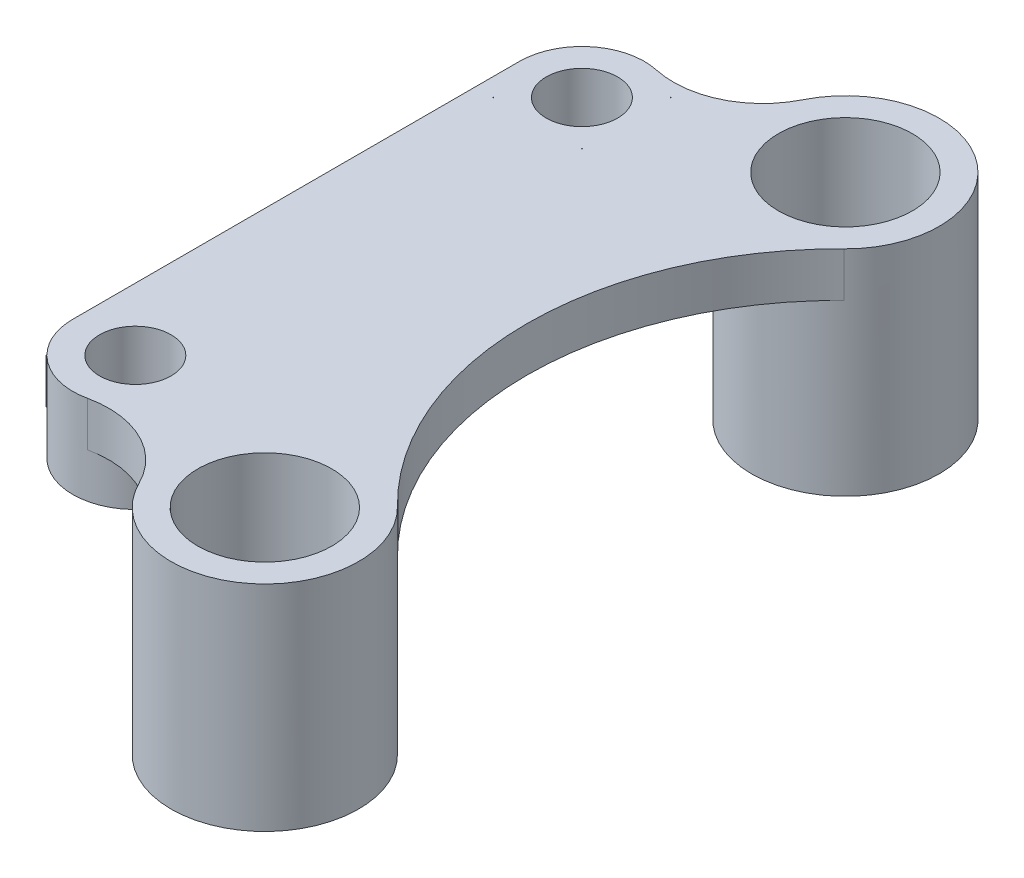
from build123d import *
from build123d.topology import SkipClean

# Parameters (mm, degrees)
SKETCH1_R                = 4
SKETCH1_R_2              = 7.5
BOSS_EXTRUDE1_DEPTH      = 5
BOSS_EXTRUDE2_START      = -5
SKETCH1_3_R              = 7
SKETCH1_3_R_2            = 4
BOSS_EXTRUDE2_DEPTH      = 5
BOSS_EXTRUDE3_DEPTH      = 5
BOSS_EXTRUDE3_DEPTH_BACK = 19
SKETCH1_4_R              = 10.5
SKETCH1_4_R_2            = 7.5


with BuildPart() as part:
    # Sketch1 → Boss-Extrude1 (new body)
    with BuildSketch(Plane(origin=(0, 0, 0), x_dir=(1, 0, 0), z_dir=(0, 1, 0))):
        with BuildLine():
            Line((2, -30), (2.101020514, -30))
            ThreePointArc((2.101020514, -30), (5.066288205, -31.727611663), (8.496335544, -31.838200051))
            ThreePointArc((8.496335544, -31.838200051), (14.961261821, -32.591823522), (19.59300275, -37.164590308))
            ThreePointArc((19.59300275, -37.164590308), (35.168768008, -40.996840663), (36.348469228, -25))
            ThreePointArc((36.348469228, -25), (25.843366656, 0), (36.348469228, 25))
            ThreePointArc((36.348469228, 25), (35.168768008, 40.996840663), (19.59300275, 37.164590308))
            ThreePointArc((19.59300275, 37.164590308), (14.961261821, 32.591823522), (8.496335544, 31.838200051))
            ThreePointArc((8.496335544, 31.838200051), (2.611056437, 30.45318021), (0, 25))
            Line((0, 25), (0, -25))
            ThreePointArc((0, -25), (0.519259302, -27.645751311), (2, -29.898979486))
            Line((2, -29.898979486), (2, -30))
        make_face()
        with Locations(Location((7, -25, 0), (0, 0, 270))):
            Circle(SKETCH1_R, mode=Mode.SUBTRACT)
        with BuildLine():
            Line((2, 20), (2, 20.101020514))
            ThreePointArc((2, 20.101020514), (2.050252532, 20.050252532), (2.101020514, 20))
            Line((2.101020514, 20), (2, 20))
        make_face(mode=Mode.SUBTRACT)
        with BuildLine():
            ThreePointArc((11.898979486, 20), (11.949747468, 20.050252532), (12, 20.101020514))
            Line((12, 20.101020514), (12, 20))
            Line((12, 20), (11.898979486, 20))
        make_face(mode=Mode.SUBTRACT)
        with Locations(Location((7, 25, 0), (0, 0, 270))):
            Circle(SKETCH1_R, mode=Mode.SUBTRACT)
        with BuildLine():
            ThreePointArc((12, 29.898979486), (11.949747468, 29.949747468), (11.898979486, 30))
            Line((11.898979486, 30), (12, 30))
            Line((12, 30), (12, 29.898979486))
        make_face(mode=Mode.SUBTRACT)
        with Locations(Location((29, 32.5, 0), (0, 0, 270))):
            Circle(SKETCH1_R_2, mode=Mode.SUBTRACT)
        with Locations(Location((29, -32.5, 0), (0, 0, 270))):
            Circle(SKETCH1_R_2, mode=Mode.SUBTRACT)
    extrude(amount=BOSS_EXTRUDE1_DEPTH)

    # Sketch1<3> → Boss-Extrude2 (add)
    # profile 1 of 2: a face of its own
    with BuildSketch(Plane(origin=(0, 0, 0), x_dir=(1, 0, 0), z_dir=(0, 1, 0)).offset(BOSS_EXTRUDE2_START)):
        with Locations(Location((7, 25, 0), (0, 0, 77.657080359))):
            Circle(SKETCH1_3_R)
        with Locations(Location((7, 25, 0), (0, 0, 270))):
            Circle(SKETCH1_3_R_2, mode=Mode.SUBTRACT)
    # profile 2 of 2: a face of its own
    with BuildSketch(Plane(origin=(0, 0, 0), x_dir=(1, 0, 0), z_dir=(0, 1, 0)).offset(BOSS_EXTRUDE2_START)):
        with Locations(Location((7, -25, 0), (0, 0, 180))):
            Circle(SKETCH1_3_R)
        with Locations(Location((7, -25, 0), (0, 0, 270))):
            Circle(SKETCH1_3_R_2, mode=Mode.SUBTRACT)
    extrude(amount=BOSS_EXTRUDE2_DEPTH)

    # Sketch1<4> → Boss-Extrude3 (add, two sides: drawn at the far end of the back side and taken through both)
    # profile 1 of 2: a face of its own
    with SkipClean():  # the faces are left unmerged after this step: merging them gives an invalid solid
        with BuildSketch(Plane(origin=(0, 0, 0), x_dir=(1, 0, 0), z_dir=(0, 1, 0)).offset(-BOSS_EXTRUDE3_DEPTH_BACK)):
            with Locations(Location((29, 32.5, 0), (0, 0, 153.62484734))):
                Circle(SKETCH1_4_R)
            with Locations(Location((29, 32.5, 0), (0, 0, 270))):
                Circle(SKETCH1_4_R_2, mode=Mode.SUBTRACT)
        # profile 2 of 2: a face of its own
        with BuildSketch(Plane(origin=(0, 0, 0), x_dir=(1, 0, 0), z_dir=(0, 1, 0)).offset(-BOSS_EXTRUDE3_DEPTH_BACK)):
            with Locations(Location((29, -32.5, 0), (0, 0, 45.584691403))):
                Circle(SKETCH1_4_R)
            with Locations(Location((29, -32.5, 0), (0, 0, 270))):
                Circle(SKETCH1_4_R_2, mode=Mode.SUBTRACT)
        extrude(amount=BOSS_EXTRUDE3_DEPTH + BOSS_EXTRUDE3_DEPTH_BACK)


solid = part.part
